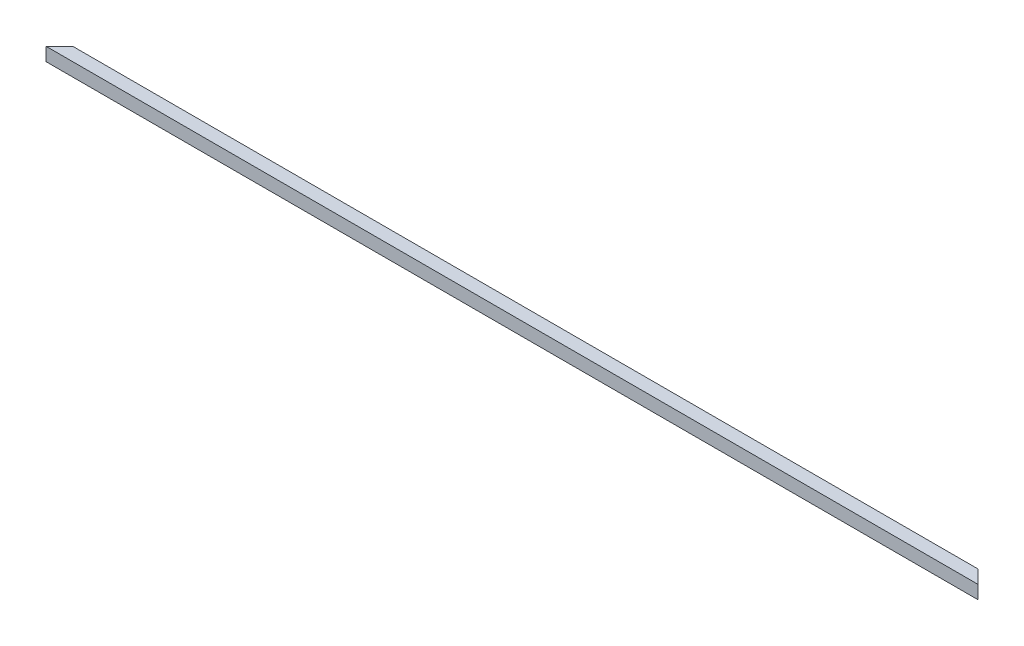
from build123d import *

# Parameters (mm, degrees)
BOSS_EXTRUDE1_DEPTH = 20


with BuildPart() as part:
    # Sketch1 → Boss-Extrude1 (new body)
    with BuildSketch(Plane(origin=(0, 0, 0), x_dir=(1, 0, 0), z_dir=(0, 1, 0))):
        Polygon((0, 0), (1397, 0), (1377, 20), (20, 20), align=None)
    extrude(amount=BOSS_EXTRUDE1_DEPTH)


solid = part.part
